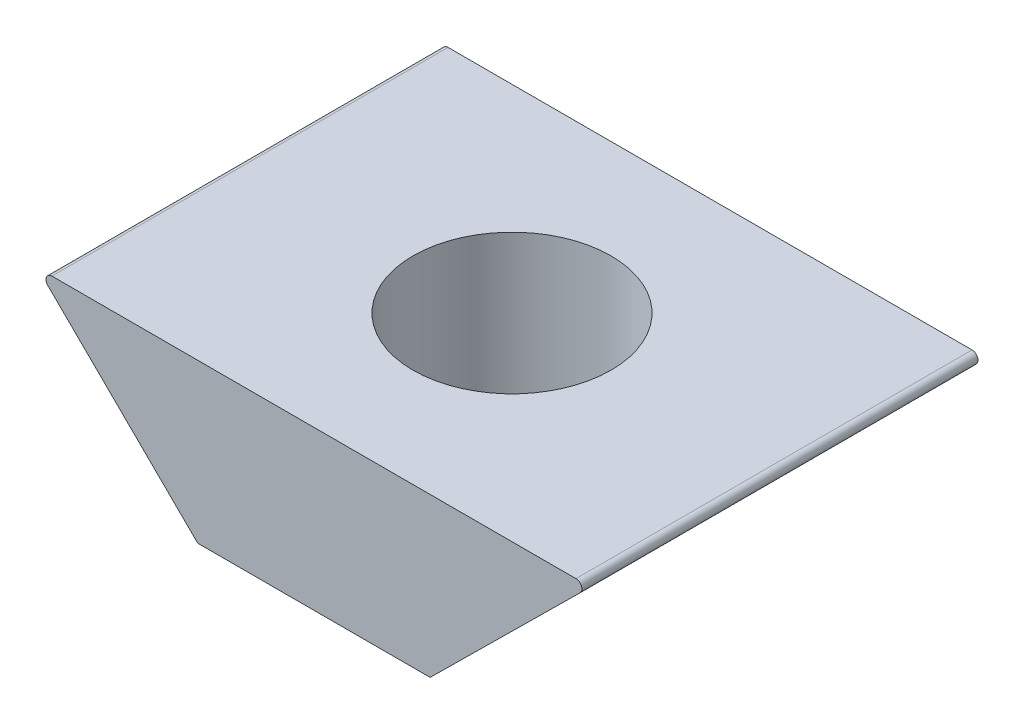
from build123d import *

# Parameters (mm, degrees)
BOSS_EXTRUDE1_DEPTH = 10
SKETCH2_R           = 2.5
CUT_EXTRUDE1_DEPTH  = 31.22831719


with BuildPart() as part:
    # Sketch1 → Boss-Extrude1 (new body)
    with BuildSketch(Plane.XY):
        with BuildLine():
            Line((-18.283811633, 4.93818979), (-14.865726836, 4.93818979))
            ThreePointArc((-14.865726836, 4.93818979), (-14.726980342, 4.84519339), (-14.760272841, 4.681515262))
            Line((-14.760272841, 4.681515262), (-18.546923839, 0.93818979))
            Line((-18.546923839, 0.93818979), (-24.41329202, 0.93818979))
            Line((-24.41329202, 0.93818979), (-28.199943018, 4.681515262))
            ThreePointArc((-28.199943018, 4.681515262), (-28.233235517, 4.84519339), (-28.094489023, 4.93818979))
            Line((-28.094489023, 4.93818979), (-24.676404226, 4.93818979))
            Line((-24.676404226, 4.93818979), (-18.283811633, 4.93818979))
        make_face()
    extrude(amount=BOSS_EXTRUDE1_DEPTH)

    # Sketch2 → Cut-Extrude1 (cut, through all)
    with BuildSketch(Plane(origin=(0, 4.93818979, 0), x_dir=(1, 0, 0), z_dir=(0, 1, 0))):
        with Locations(Location((-21.480107929, -5, 0), (0, 0, 180))):
            Circle(SKETCH2_R)
    extrude(amount=-CUT_EXTRUDE1_DEPTH, mode=Mode.SUBTRACT)


solid = part.part
